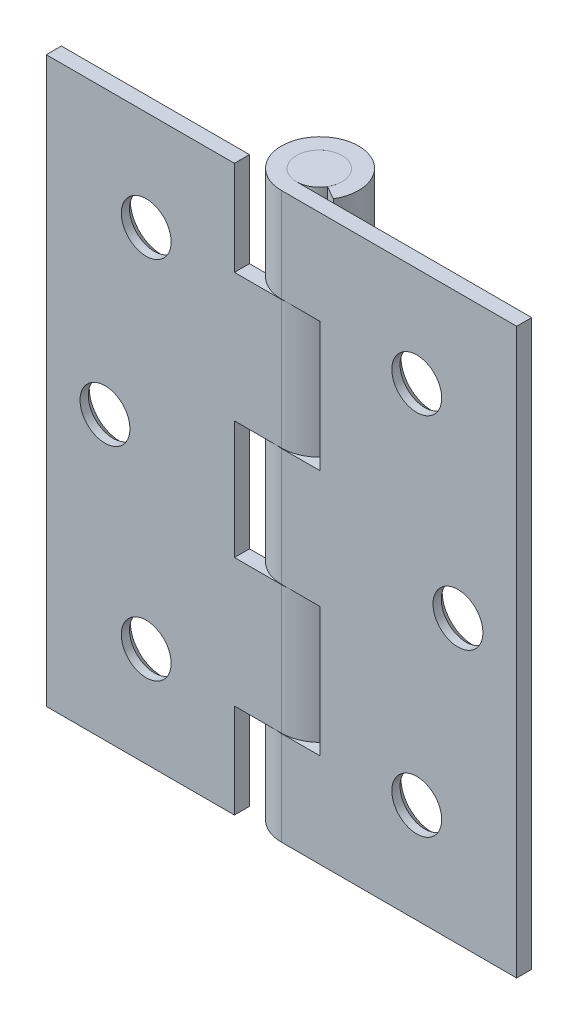
from build123d import *

# Parameters (mm, degrees)
EXTRUDE1_DEPTH                                = 38.1
CUT_EXTRUDE1_DEPTH                            = 51.298413732
CUT_EXTRUDE1_DEPTH_BACK                       = 51.298413732
EXTRUDE2_DEPTH                                = 8.68045
EXTRUDE2_DEPTH_BACK                           = 8.68045
EXTRUDE3_DEPTH                                = 8.68045
EXTRUDE3_DEPTH_BACK                           = 8.68045
EXTRUDE4_START                                = -21.43125
SKETCH5_W                                     = 25.4
SKETCH5_H                                     = 2.032
EXTRUDE4_DEPTH                                = 76.2
SKETCH6_W                                     = 3.0734
SKETCH6_H                                     = 76.2
CSK_FOR_8_FLAT_HEAD_MACHINE_SCREW2_AT_2_COUNT = 2
CSK_FOR_8_FLAT_HEAD_MACHINE_SCREW2_AT_2_PITCH = 25.258138545
CSK_FOR_8_FLAT_HEAD_MACHINE_SCREW2_AT_3_COUNT = 2
CSK_FOR_8_FLAT_HEAD_MACHINE_SCREW2_AT_3_PITCH = 25.258138545
CSK_FOR_8_FLAT_HEAD_MACHINE_SCREW2_AT_4_COUNT = 2
CSK_FOR_8_FLAT_HEAD_MACHINE_SCREW2_AT_4_PITCH = 48.768985563
CSK_FOR_8_FLAT_HEAD_MACHINE_SCREW2_AT_5_COUNT = 2
CSK_FOR_8_FLAT_HEAD_MACHINE_SCREW2_AT_5_PITCH = 47.6504
CSK_FOR_8_FLAT_HEAD_MACHINE_SCREW2_AT_6_COUNT = 2
CSK_FOR_8_FLAT_HEAD_MACHINE_SCREW2_AT_6_PITCH = 48.768985563


with BuildPart() as part:
    # Sketch1 → Extrude1 (new, symmetric)
    with BuildSketch(Plane(origin=(0, 0, 0), x_dir=(1, 0, 0), z_dir=(0, 1, 0))):
        with BuildLine():
            Line((0, -3.0734), (31.75, -3.0734))
            Line((31.75, -3.0734), (31.75, -5.1054))
            Line((31.75, -5.1054), (0, -5.1054))
            ThreePointArc((0, -5.1054), (-2.565305705, 4.63283114), (4.464756325, -2.577728266))
            Line((4.464756325, -2.577728266), (2.661642476, -1.5367))
            ThreePointArc((2.661642476, -1.5367), (-1.5367, 2.661642476), (0, -3.0734))
        make_face()
    extrude(amount=EXTRUDE1_DEPTH, both=True)

    # Sketch2 → Cut-Extrude1 (cut, two sides: drawn at the far end of the back side and taken through both)
    with BuildSketch(Plane(origin=(0, 0, 3.0734), x_dir=(-1, 0, 0), z_dir=(0, 0, -1)).offset(-CUT_EXTRUDE1_DEPTH_BACK)):
        Polygon((5.207, 217.478391172), (5.207, 38.1), (5.207, 25.4), (-5.207, 25.4), (-5.207, 7.9375), (5.207, 7.9375), (5.207, -7.9375), (-5.207, -7.9375), (-5.207, -25.4), (5.207, -25.4), (5.207, -38.1), (5.207, -217.478391172), (363.963782344, -217.478391172), (363.963782344, 217.478391172), align=None)
    extrude(amount=CUT_EXTRUDE1_DEPTH + CUT_EXTRUDE1_DEPTH_BACK, mode=Mode.SUBTRACT)


with BuildPart() as body_2:
    # Sketch3 → Extrude2 (new, two sides: drawn at the far end of the back side and taken through both)
    with BuildSketch(Plane(origin=(0, 16.66875, 0), x_dir=(-1, 0, 0), z_dir=(0, 1, 0)).offset(-EXTRUDE2_DEPTH_BACK)):
        with BuildLine():
            Line((31.75, 5.1054), (31.75, 3.0734))
            Line((31.75, 3.0734), (0, 3.0734))
            ThreePointArc((0, 3.0734), (-1.5367, -2.661642476), (2.661642476, 1.5367))
            Line((2.661642476, 1.5367), (4.434312541, 2.627817757))
            ThreePointArc((4.434312541, 2.627817757), (-2.539760888, -4.64719827), (0, 5.1054))
            Line((0, 5.1054), (31.75, 5.1054))
        make_face()
    extrude(amount=EXTRUDE2_DEPTH + EXTRUDE2_DEPTH_BACK)



with BuildPart() as body_3:
    # Sketch4 → Extrude3 (new, two sides: drawn at the far end of the back side and taken through both)
    with BuildSketch(Plane(origin=(0, -16.66875, 0), x_dir=(-1, 0, 0), z_dir=(0, 1, 0)).offset(-EXTRUDE3_DEPTH_BACK)):
        with BuildLine():
            Line((0, 3.0734), (31.75, 3.0734))
            Line((31.75, 3.0734), (31.75, 5.1054))
            Line((31.75, 5.1054), (0, 5.1054))
            ThreePointArc((0, 5.1054), (-2.539760888, -4.64719827), (4.434312541, 2.627817757))
            Line((4.434312541, 2.627817757), (2.661642476, 1.5367))
            ThreePointArc((2.661642476, 1.5367), (-1.5367, -2.661642476), (0, 3.0734))
        make_face()
    extrude(amount=EXTRUDE3_DEPTH + EXTRUDE3_DEPTH_BACK)


with BuildPart() as body_2_1:
    add(body_2.part)

    add(body_3.part)  # Extrude4 merges body 3
    # Sketch5 → Extrude4 (add)
    with BuildSketch(Plane(origin=(0, -16.66875, 0), x_dir=(-1, 0, 0), z_dir=(0, 1, 0)).offset(EXTRUDE4_START)):
        with Locations((19.05, 4.0894)):
            Rectangle(SKETCH5_W, SKETCH5_H)
    extrude(amount=EXTRUDE4_DEPTH)

    # Sketch9 → CSK for #8 Flat Head Machine Screw2 (revolve, cut)
    with BuildSketch(Plane(origin=(-23.8252, 0, 3.0734), x_dir=(0, 1, 0), z_dir=(1, 0, 0))):
        Polygon((0, 0), (0, 4.130193213), (3.3655, 2.1079968), (3.3655, 0.920409763), (4.1656, 0), align=None)
    csk_for_8_flat_head_machine_screw2 = revolve(axis=Axis((-23.8252, 0, -3.2766), (0, 0, 1)), mode=Mode.SUBTRACT)

    # CSK for #8 Flat Head Machine Screw2 at 2: CSK for #8 Flat Head Machine Screw2 ×2
    with Locations(*[Vector(0.22023000586851396, 0.9754479711984408, 0) * (i * CSK_FOR_8_FLAT_HEAD_MACHINE_SCREW2_AT_2_PITCH) for i in range(1, CSK_FOR_8_FLAT_HEAD_MACHINE_SCREW2_AT_2_COUNT)]):
        add(csk_for_8_flat_head_machine_screw2, mode=Mode.SUBTRACT)

    # CSK for #8 Flat Head Machine Screw2 at 3: CSK for #8 Flat Head Machine Screw2 ×2
    with Locations(*[Vector(0.22023000586851396, -0.9754479711984408, 0) * (i * CSK_FOR_8_FLAT_HEAD_MACHINE_SCREW2_AT_3_PITCH) for i in range(1, CSK_FOR_8_FLAT_HEAD_MACHINE_SCREW2_AT_3_COUNT)]):
        add(csk_for_8_flat_head_machine_screw2, mode=Mode.SUBTRACT)


with BuildPart() as body_3_2:
    # Sketch6 → Revolve1 (revolve)
    with BuildSketch(Plane.XY):
        with Locations((-1.5367, 0)):
            Rectangle(SKETCH6_W, SKETCH6_H)
    revolve(axis=Axis((0, 42.361566849, 0), (0, -1, 0)))


with BuildPart() as part_1:
    add(part.part)

    # CSK for #8 Flat Head Machine Screw2 at 4: CSK for #8 Flat Head Machine Screw2 ×2
    with Locations(*[Vector(0.8630033927129176, -0.5051981236762403, 0) * (i * CSK_FOR_8_FLAT_HEAD_MACHINE_SCREW2_AT_4_PITCH) for i in range(1, CSK_FOR_8_FLAT_HEAD_MACHINE_SCREW2_AT_4_COUNT)]):
        add(csk_for_8_flat_head_machine_screw2, mode=Mode.SUBTRACT)

    # CSK for #8 Flat Head Machine Screw2 at 5: CSK for #8 Flat Head Machine Screw2 ×2
    with Locations(*[(i * CSK_FOR_8_FLAT_HEAD_MACHINE_SCREW2_AT_5_PITCH, 0, 0) for i in range(1, CSK_FOR_8_FLAT_HEAD_MACHINE_SCREW2_AT_5_COUNT)]):
        add(csk_for_8_flat_head_machine_screw2, mode=Mode.SUBTRACT)

    # CSK for #8 Flat Head Machine Screw2 at 6: CSK for #8 Flat Head Machine Screw2 ×2
    with Locations(*[Vector(0.8630033927129176, 0.5051981236762403, 0) * (i * CSK_FOR_8_FLAT_HEAD_MACHINE_SCREW2_AT_6_PITCH) for i in range(1, CSK_FOR_8_FLAT_HEAD_MACHINE_SCREW2_AT_6_COUNT)]):
        add(csk_for_8_flat_head_machine_screw2, mode=Mode.SUBTRACT)


solid = Compound([body_2_1.part, body_3_2.part, part_1.part])
